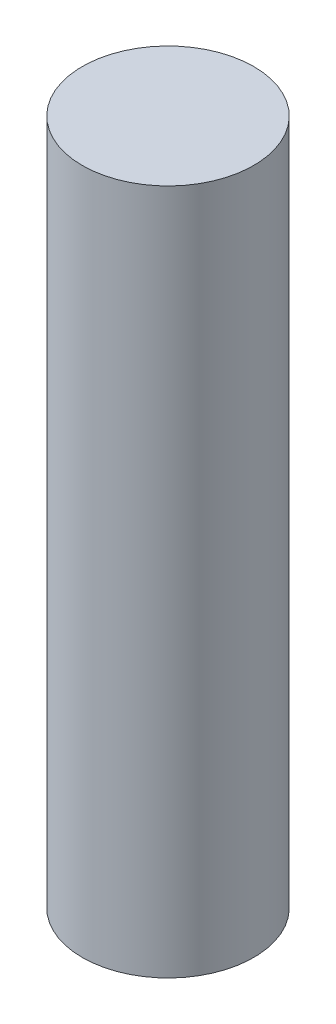
from build123d import *

# Parameters (mm, degrees)
SKETCH1_R           = 3
BOSS_EXTRUDE1_DEPTH = 24


with BuildPart() as part:
    # Sketch1 → Boss-Extrude1 (new body)
    with BuildSketch(Plane(origin=(0, 0, 0), x_dir=(1, 0, 0), z_dir=(0, 1, 0))):
        with Locations(Location((0, 0, 0), (0, 0, 270))):
            Circle(SKETCH1_R)
    extrude(amount=BOSS_EXTRUDE1_DEPTH)


solid = part.part
